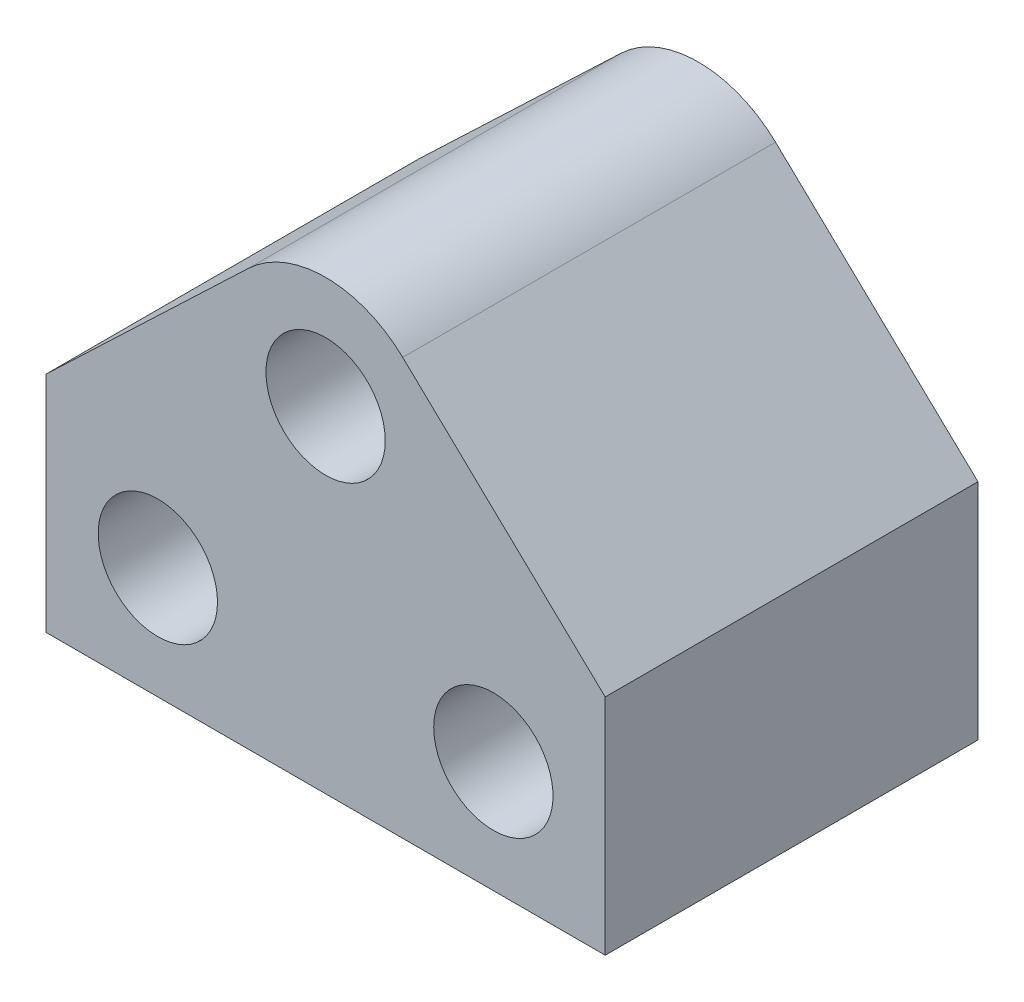
from build123d import *

# Parameters (mm, degrees)
SKETCH1_R           = 1.6
BOSS_EXTRUDE1_DEPTH = 10


with BuildPart() as part:
    # Sketch1 → Boss-Extrude1 (new body)
    with BuildSketch(Plane.XY):
        with BuildLine():
            Line((-7.5, 6), (-2.068965517, 11.172413793))
            ThreePointArc((-2.068965517, 11.172413793), (0, 12), (2.068965517, 11.172413793))
            Line((2.068965517, 11.172413793), (7.5, 6))
            Line((7.5, 6), (7.5, 0))
            Line((7.5, 0), (-7.5, 0))
            Line((-7.5, 0), (-7.5, 6))
        make_face()
        with Locations((0, 9)):
            Circle(SKETCH1_R, mode=Mode.SUBTRACT)
        with Locations((-4.5, 3)):
            Circle(SKETCH1_R, mode=Mode.SUBTRACT)
        with Locations(Location((4.5, 3, 0), (0, 0, 180))):
            Circle(SKETCH1_R, mode=Mode.SUBTRACT)
    extrude(amount=BOSS_EXTRUDE1_DEPTH)


solid = part.part
